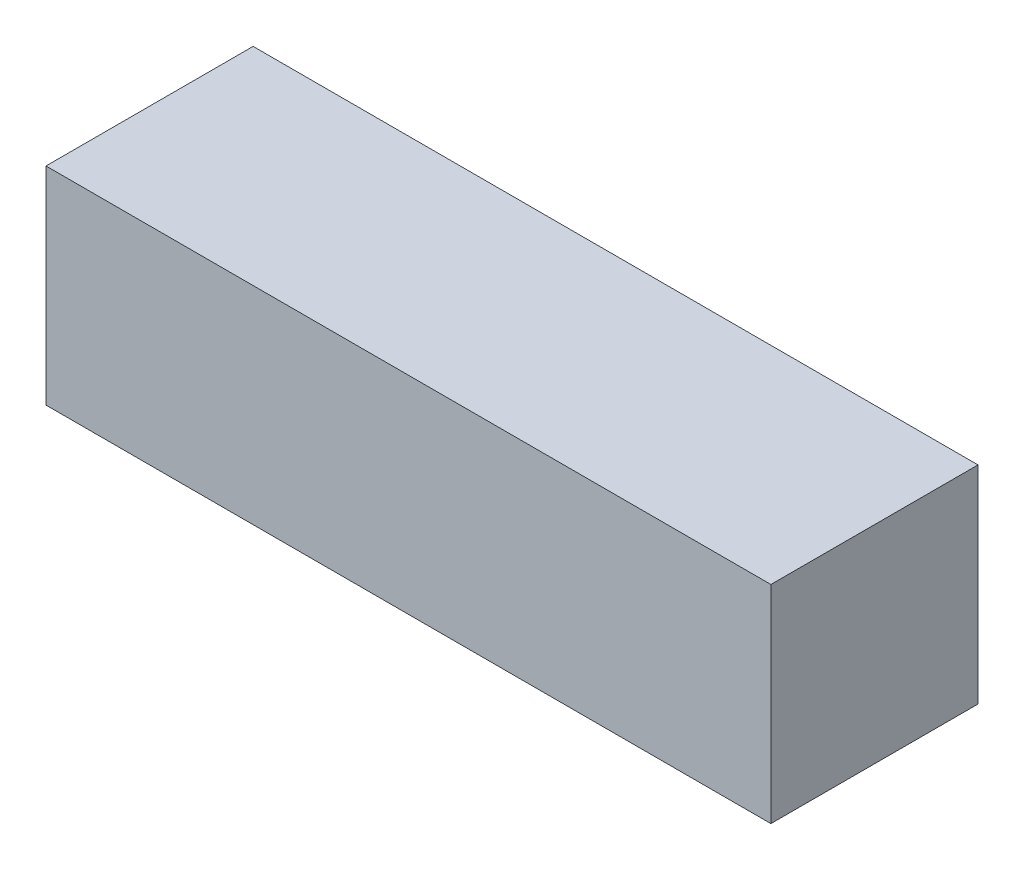
from build123d import *

# Parameters (mm, degrees)
SKETCH1_W           = 177.8
SKETCH1_H           = 50.8
BOSS_EXTRUDE1_DEPTH = 50.8


with BuildPart() as part:
    # Sketch1 → Boss-Extrude1 (new body)
    with BuildSketch(Plane(origin=(0, 0, 0), x_dir=(1, 0, 0), z_dir=(0, 1, 0))):
        with Locations((88.9, 25.4)):
            Rectangle(SKETCH1_W, SKETCH1_H)
    extrude(amount=BOSS_EXTRUDE1_DEPTH)


solid = part.part
